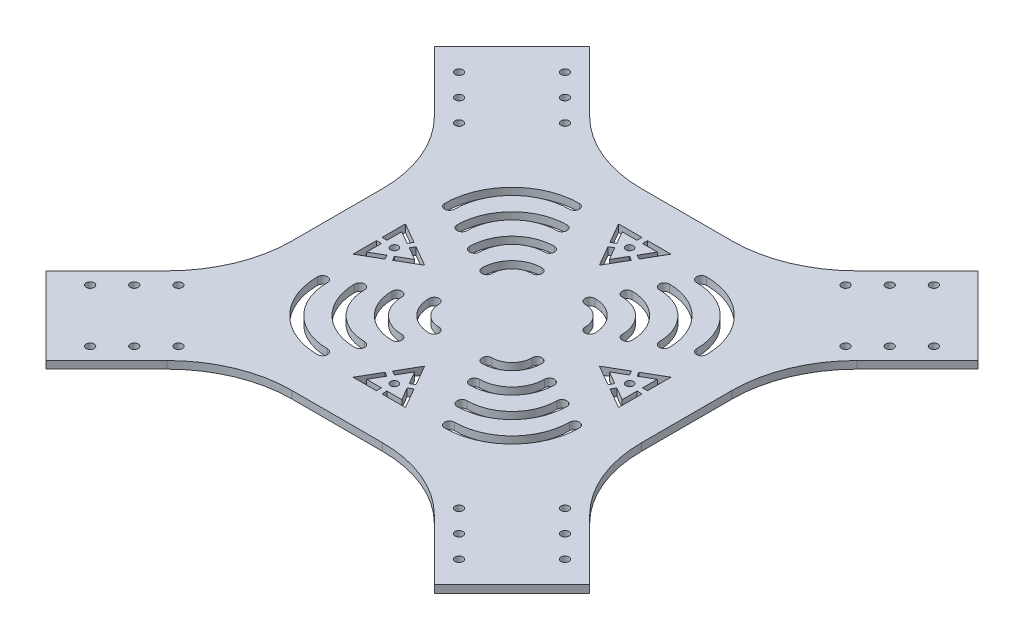
from build123d import *

# Parameters (mm, degrees)
IZIM1_W                     = 140
IZIM1_H                     = 140
Y_KSEKLIK_EKSTR_ZYON1_DEPTH = 3
RADYUS1_R                   = 50
IZIM2_R                     = 1.5
KES_EKSTR_ZYON1_DEPTH       = 4
IZIM3_R                     = 1.6
KES_EKSTR_ZYON2_DEPTH       = 50


with BuildPart() as part:
    # Çizim1 → Yükseklik-Ekstrüzyon1 (new body)
    with BuildSketch(Plane(origin=(0, 0, 0), x_dir=(1, 0, 0), z_dir=(0, 1, 0))):
        Rectangle(IZIM1_W, IZIM1_H)
        Polygon((-77.778174593, 108.890872965), (-108.890872965, 77.778174593), (-70, 38.887301628), (-70, 70), (-38.887301628, 70), align=None)
        Polygon((-70, -70), (-70, -38.887301628), (-108.890872965, -77.778174593), (-77.778174593, -108.890872965), (-38.887301628, -70), align=None)
        Polygon((70, -70), (38.887301628, -70), (77.778174593, -108.890872965), (108.890872965, -77.778174593), (70, -38.887301628), align=None)
        Polygon((77.778174593, 108.890872965), (38.887301628, 70), (70, 70), (70, 38.887301628), (108.890872965, 77.778174593), align=None)
    extrude(amount=Y_KSEKLIK_EKSTR_ZYON1_DEPTH)

    # Radyus1
    radyus1_edges = [part.edges().sort_by_distance(p)[0] for p in [
        (-70, 1.5, 38.887301628),
        (-70, 1.5, -38.887301628),
        (-38.887301628, 1.5, -70),
        (38.887301628, 1.5, -70),
        (70, 1.5, -38.887301628),
        (70, 1.5, 38.887301628),
        (38.887301628, 1.5, 70),
        (-38.887301628, 1.5, 70),
    ]]
    fillet(radyus1_edges, radius=RADYUS1_R)

    # Çizim2 → Kes-Ekstrüzyon1 (cut)
    with BuildSketch(Plane(origin=(0, 3, 0), x_dir=(1, 0, 0), z_dir=(0, 1, 0))):
        with BuildLine():
            ThreePointArc((-25.455844123, 52.455844123), (-44.547727215, 44.547727215), (-52.455844123, 25.455844123))
            ThreePointArc((-52.455844123, 25.455844123), (-50.455844123, 23.455844123), (-48.455844123, 25.455844123))
            ThreePointArc((-48.455844123, 25.455844123), (-41.71930009, 41.71930009), (-25.455844123, 48.455844123))
            ThreePointArc((-25.455844123, 48.455844123), (-23.455844123, 50.455844123), (-25.455844123, 52.455844123))
        make_face()
        with BuildLine():
            ThreePointArc((-20.506096654, 42.506096654), (-36.062445841, 36.062445841), (-42.506096654, 20.506096654))
            ThreePointArc((-42.506096654, 20.506096654), (-40.506096654, 18.506096654), (-38.506096654, 20.506096654))
            ThreePointArc((-38.506096654, 20.506096654), (-33.234018716, 33.234018716), (-20.506096654, 38.506096654))
            ThreePointArc((-20.506096654, 38.506096654), (-18.506096654, 40.506096654), (-20.506096654, 42.506096654))
        make_face()
        with BuildLine():
            ThreePointArc((-10.606601718, 22.606601718), (-19.091883092, 19.091883092), (-22.606601718, 10.606601718))
            ThreePointArc((-22.606601718, 10.606601718), (-20.606601718, 8.606601718), (-18.606601718, 10.606601718))
            ThreePointArc((-18.606601718, 10.606601718), (-16.263455967, 16.263455967), (-10.606601718, 18.606601718))
            ThreePointArc((-10.606601718, 18.606601718), (-8.606601718, 20.606601718), (-10.606601718, 22.606601718))
        make_face()
        with BuildLine():
            ThreePointArc((18.606601718, 10.606601718), (16.263455967, 16.263455967), (10.606601718, 18.606601718))
            ThreePointArc((10.606601718, 18.606601718), (8.606601718, 20.606601718), (10.606601718, 22.606601718))
            ThreePointArc((10.606601718, 22.606601718), (19.091883092, 19.091883092), (22.606601718, 10.606601718))
            ThreePointArc((22.606601718, 10.606601718), (20.606601718, 8.606601718), (18.606601718, 10.606601718))
        make_face()
        with BuildLine():
            ThreePointArc((28.556349186, 15.556349186), (24.748737342, 24.748737342), (15.556349186, 28.556349186))
            ThreePointArc((15.556349186, 28.556349186), (13.556349186, 30.556349186), (15.556349186, 32.556349186))
            ThreePointArc((15.556349186, 32.556349186), (27.577164466, 27.577164466), (32.556349186, 15.556349186))
            ThreePointArc((32.556349186, 15.556349186), (30.556349186, 13.556349186), (28.556349186, 15.556349186))
        make_face()
        with BuildLine():
            ThreePointArc((38.506096654, 20.506096654), (33.234018716, 33.234018716), (20.506096654, 38.506096654))
            ThreePointArc((20.506096654, 38.506096654), (18.506096654, 40.506096654), (20.506096654, 42.506096654))
            ThreePointArc((20.506096654, 42.506096654), (36.062445841, 36.062445841), (42.506096654, 20.506096654))
            ThreePointArc((42.506096654, 20.506096654), (40.506096654, 18.506096654), (38.506096654, 20.506096654))
        make_face()
        with BuildLine():
            ThreePointArc((48.455844123, 25.455844123), (41.71930009, 41.71930009), (25.455844123, 48.455844123))
            ThreePointArc((25.455844123, 48.455844123), (23.455844123, 50.455844123), (25.455844123, 52.455844123))
            ThreePointArc((25.455844123, 52.455844123), (44.547727215, 44.547727215), (52.455844123, 25.455844123))
            ThreePointArc((52.455844123, 25.455844123), (50.455844123, 23.455844123), (48.455844123, 25.455844123))
        make_face()
        with BuildLine():
            ThreePointArc((-48.455844123, -25.455844123), (-41.71930009, -41.71930009), (-25.455844123, -48.455844123))
            ThreePointArc((-25.455844123, -48.455844123), (-23.455844123, -50.455844123), (-25.455844123, -52.455844123))
            ThreePointArc((-25.455844123, -52.455844123), (-44.547727215, -44.547727215), (-52.455844123, -25.455844123))
            ThreePointArc((-52.455844123, -25.455844123), (-50.455844123, -23.455844123), (-48.455844123, -25.455844123))
        make_face()
        with BuildLine():
            ThreePointArc((-38.506096654, -20.506096654), (-33.234018716, -33.234018716), (-20.506096654, -38.506096654))
            ThreePointArc((-20.506096654, -38.506096654), (-18.506096654, -40.506096654), (-20.506096654, -42.506096654))
            ThreePointArc((-20.506096654, -42.506096654), (-36.062445841, -36.062445841), (-42.506096654, -20.506096654))
            ThreePointArc((-42.506096654, -20.506096654), (-40.506096654, -18.506096654), (-38.506096654, -20.506096654))
        make_face()
        with BuildLine():
            ThreePointArc((-28.556349186, -15.556349186), (-24.748737342, -24.748737342), (-15.556349186, -28.556349186))
            ThreePointArc((-15.556349186, -28.556349186), (-13.556349186, -30.556349186), (-15.556349186, -32.556349186))
            ThreePointArc((-15.556349186, -32.556349186), (-27.577164466, -27.577164466), (-32.556349186, -15.556349186))
            ThreePointArc((-32.556349186, -15.556349186), (-30.556349186, -13.556349186), (-28.556349186, -15.556349186))
        make_face()
        with BuildLine():
            ThreePointArc((-18.606601718, -10.606601718), (-16.263455967, -16.263455967), (-10.606601718, -18.606601718))
            ThreePointArc((-10.606601718, -18.606601718), (-8.606601718, -20.606601718), (-10.606601718, -22.606601718))
            ThreePointArc((-10.606601718, -22.606601718), (-19.091883092, -19.091883092), (-22.606601718, -10.606601718))
            ThreePointArc((-22.606601718, -10.606601718), (-20.606601718, -8.606601718), (-18.606601718, -10.606601718))
        make_face()
        Polygon((4.7, -43.140638796), (0, -35), (-4.7, -43.140638796), (-2.967949192, -44.140638796), (0, -39), (2.967949192, -44.140638796), align=None)
        Polygon((-4.067949192, -46.045894684), (-5.8, -45.045894684), (-10.5, -53.186533479), (-1.1, -53.186533479), (-1.1, -51.18653348), (-7.035898385, -51.186533479), align=None)
        Polygon((10.5, -53.186533479), (5.8, -45.045894684), (4.067949192, -46.045894684), (7.035898385, -51.186533479), (1.1, -51.18653348), (1.1, -53.18653348), align=None)
        with BuildLine():
            ThreePointArc((20.506096654, -38.506096654), (33.234018716, -33.234018716), (38.506096654, -20.506096654))
            ThreePointArc((38.506096654, -20.506096654), (40.506096654, -18.506096654), (42.506096654, -20.506096654))
            ThreePointArc((42.506096654, -20.506096654), (36.062445841, -36.062445841), (20.506096654, -42.506096654))
            ThreePointArc((20.506096654, -42.506096654), (18.506096654, -40.506096654), (20.506096654, -38.506096654))
        make_face()
        with BuildLine():
            ThreePointArc((10.606601718, -18.606601718), (16.263455967, -16.263455967), (18.606601718, -10.606601718))
            ThreePointArc((18.606601718, -10.606601718), (20.606601718, -8.606601718), (22.606601718, -10.606601718))
            ThreePointArc((22.606601718, -10.606601718), (19.091883092, -19.091883092), (10.606601718, -22.606601718))
            ThreePointArc((10.606601718, -22.606601718), (8.606601718, -20.606601718), (10.606601718, -18.606601718))
        make_face()
        with BuildLine():
            ThreePointArc((15.556349186, -28.556349186), (24.748737342, -24.748737342), (28.556349186, -15.556349186))
            ThreePointArc((28.556349186, -15.556349186), (30.556349186, -13.556349186), (32.556349186, -15.556349186))
            ThreePointArc((32.556349186, -15.556349186), (27.577164466, -27.577164466), (15.556349186, -32.556349186))
            ThreePointArc((15.556349186, -32.556349186), (13.556349186, -30.556349186), (15.556349186, -28.556349186))
        make_face()
        with BuildLine():
            ThreePointArc((25.455844123, -48.455844123), (41.71930009, -41.71930009), (48.455844123, -25.455844123))
            ThreePointArc((48.455844123, -25.455844123), (50.455844123, -23.455844123), (52.455844123, -25.455844123))
            ThreePointArc((52.455844123, -25.455844123), (44.547727215, -44.547727215), (25.455844123, -52.455844123))
            ThreePointArc((25.455844123, -52.455844123), (23.455844123, -50.455844123), (25.455844123, -48.455844123))
        make_face()
        Polygon((53.186533479, 10.5), (45.045894684, 5.8), (46.045894684, 4.067949192), (51.186533479, 7.035898385), (51.18653348, 1.1), (53.18653348, 1.1), align=None)
        Polygon((46.045894684, -4.067949192), (45.045894684, -5.8), (53.186533479, -10.5), (53.186533479, -1.1), (51.18653348, -1.1), (51.186533479, -7.035898385), align=None)
        Polygon((43.140638796, 4.7), (35, 0), (43.140638796, -4.7), (44.140638796, -2.967949192), (39, 0), (44.140638796, 2.967949192), align=None)
        with Locations(Location((47.124355653, 0, 0), (0, 0, 270))):
            Circle(IZIM2_R)
        Polygon((-4.7, 43.140638796), (0, 35), (4.7, 43.140638796), (2.967949192, 44.140638796), (0, 39), (-2.967949192, 44.140638796), align=None)
        Polygon((4.067949192, 46.045894684), (5.8, 45.045894684), (10.5, 53.186533479), (1.1, 53.186533479), (1.1, 51.18653348), (7.035898385, 51.186533479), align=None)
        with Locations(Location((0, 47.124355653, 0), (0, 0, 270))):
            Circle(IZIM2_R)
        Polygon((-10.5, 53.186533479), (-5.8, 45.045894684), (-4.067949192, 46.045894684), (-7.035898385, 51.186533479), (-1.1, 51.18653348), (-1.1, 53.18653348), align=None)
        Polygon((-44.140638796, -2.967949192), (-43.140638796, -4.7), (-35, 0), (-43.140638796, 4.7), (-44.140638796, 2.967949192), (-39, 0), align=None)
        Polygon((-53.186533479, -1.1), (-53.186533479, -10.5), (-45.045894684, -5.8), (-46.045894684, -4.067949192), (-51.186533479, -7.035898385), (-51.18653348, -1.1), align=None)
        Polygon((-53.186533479, 10.5), (-53.186533479, 1.1), (-51.18653348, 1.1), (-51.186533479, 7.035898385), (-46.045894684, 4.067949192), (-45.045894684, 5.8), align=None)
        with Locations(Location((-47.124355653, 0, 0), (0, 0, 270))):
            Circle(IZIM2_R)
        with BuildLine():
            ThreePointArc((-15.556349186, 32.556349186), (-27.577164466, 27.577164466), (-32.556349186, 15.556349186))
            ThreePointArc((-32.556349186, 15.556349186), (-30.556349186, 13.556349186), (-28.556349186, 15.556349186))
            ThreePointArc((-28.556349186, 15.556349186), (-24.748737342, 24.748737342), (-15.556349186, 28.556349186))
            ThreePointArc((-15.556349186, 28.556349186), (-13.556349186, 30.556349186), (-15.556349186, 32.556349186))
        make_face()
        with Locations(Location((0, -47.124355653, 0), (0, 0, 270))):
            Circle(IZIM2_R)
    extrude(amount=-KES_EKSTR_ZYON1_DEPTH, mode=Mode.SUBTRACT)

    # Çizim3 → Kes-Ekstrüzyon2 (cut)
    with BuildSketch(Plane(origin=(0, 3, 0), x_dir=(1, 0, 0), z_dir=(0, 1, 0))):
        with Locations(Location((-95.102290732, 73.889087297, 0), (0, 0, 270))):
            Circle(IZIM3_R)
        with Locations(Location((-86.263455967, 65.050252532, 0), (0, 0, 270))):
            Circle(IZIM3_R)
        with Locations(Location((-77.424621202, 56.211417767, 0), (0, 0, 270))):
            Circle(IZIM3_R)
        with Locations(Location((-56.211417767, 77.424621202, 0), (0, 0, 270))):
            Circle(IZIM3_R)
        with Locations(Location((-65.050252532, 86.263455967, 0), (0, 0, 270))):
            Circle(IZIM3_R)
        with Locations(Location((-73.889087297, 95.102290732, 0), (0, 0, 270))):
            Circle(IZIM3_R)
        with Locations(Location((56.211417767, 77.424621202, 0), (0, 0, 270))):
            Circle(IZIM3_R)
        with Locations(Location((65.050252532, 86.263455967, 0), (0, 0, 270))):
            Circle(IZIM3_R)
        with Locations(Location((73.889087297, 95.102290732, 0), (0, 0, 270))):
            Circle(IZIM3_R)
        with Locations(Location((77.424621202, 56.211417767, 0), (0, 0, 270))):
            Circle(IZIM3_R)
        with Locations(Location((86.263455967, 65.050252532, 0), (0, 0, 270))):
            Circle(IZIM3_R)
        with Locations(Location((95.102290732, 73.889087297, 0), (0, 0, 270))):
            Circle(IZIM3_R)
        with Locations(Location((77.424621202, -56.211417767, 0), (0, 0, 270))):
            Circle(IZIM3_R)
        with Locations(Location((86.263455967, -65.050252532, 0), (0, 0, 270))):
            Circle(IZIM3_R)
        with Locations(Location((95.102290732, -73.889087297, 0), (0, 0, 270))):
            Circle(IZIM3_R)
        with Locations(Location((56.211417767, -77.424621202, 0), (0, 0, 270))):
            Circle(IZIM3_R)
        with Locations(Location((65.050252532, -86.263455967, 0), (0, 0, 270))):
            Circle(IZIM3_R)
        with Locations(Location((73.889087297, -95.102290732, 0), (0, 0, 270))):
            Circle(IZIM3_R)
        with Locations(Location((-56.211417767, -77.424621202, 0), (0, 0, 270))):
            Circle(IZIM3_R)
        with Locations(Location((-65.050252532, -86.263455967, 0), (0, 0, 270))):
            Circle(IZIM3_R)
        with Locations(Location((-73.889087297, -95.102290732, 0), (0, 0, 270))):
            Circle(IZIM3_R)
        with Locations(Location((-77.424621202, -56.211417767, 0), (0, 0, 270))):
            Circle(IZIM3_R)
        with Locations(Location((-86.263455967, -65.050252532, 0), (0, 0, 270))):
            Circle(IZIM3_R)
        with Locations(Location((-95.102290732, -73.889087297, 0), (0, 0, 270))):
            Circle(IZIM3_R)
    extrude(amount=-KES_EKSTR_ZYON2_DEPTH, mode=Mode.SUBTRACT)


solid = part.part
